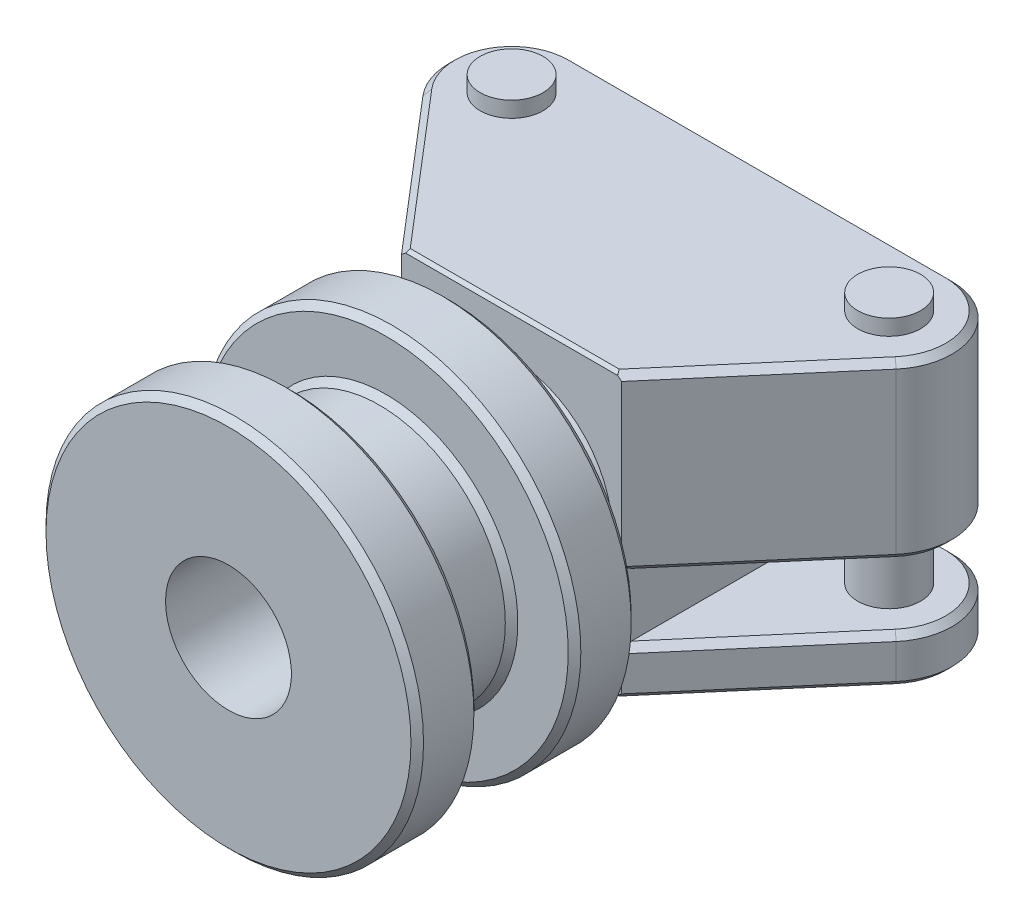
from build123d import *

# Parameters (mm, degrees)
SKETCH1_R                = 6
BOSS_EXTRUDE1_DEPTH      = 2
SKETCH2_R                = 4
BOSS_EXTRUDE2_DEPTH      = 3
BOSS_EXTRUDE3_START      = 2
SKETCH3_R                = 6
BOSS_EXTRUDE3_DEPTH      = 2
SKETCH4_R                = 3
BOSS_EXTRUDE4_DEPTH      = 2
SKETCH5_R                = 1
BOSS_EXTRUDE5_DEPTH      = 4.5
CUT_EXTRUDE1_REACH       = 21.723
SKETCH6_W                = 4.5
SKETCH6_H                = 2
SKETCH7_R                = 2
CUT_EXTRUDE2_DEPTH       = 20.723082923
CHAMFER1_SIZE            = 0.2
CHAMFER2_SIZE            = 0.1
BOSS_EXTRUDE6_DEPTH      = 0.5
BOSS_EXTRUDE6_DEPTH_BACK = 9.5
SKETCH8_R                = 1
BOSS_EXTRUDE7_DEPTH      = 0.5
BOSS_EXTRUDE7_DEPTH_BACK = 9.5
SKETCH9_R                = 1


with BuildPart() as part:
    # Sketch1 → Boss-Extrude1 (new body)
    with BuildSketch(Plane.XY):
        Circle(SKETCH1_R)
    extrude(amount=BOSS_EXTRUDE1_DEPTH)

    # Sketch2 → Boss-Extrude2 (add)
    with BuildSketch(Plane(origin=(0, 0, 0), x_dir=(-1, 0, 0), z_dir=(0, 0, -1))):
        Circle(SKETCH2_R)
    extrude(amount=BOSS_EXTRUDE2_DEPTH)

    # Sketch3 → Boss-Extrude3 (add)
    with BuildSketch(Plane(origin=(0, 0, -3), x_dir=(-1, 0, 0), z_dir=(0, 0, -1)).offset(BOSS_EXTRUDE3_START)):
        with Locations(Location((0, 0, 0), (0, 0, 180))):
            Circle(SKETCH3_R)
    extrude(amount=-BOSS_EXTRUDE3_DEPTH)

    # Sketch4 → Boss-Extrude4 (add)
    with BuildSketch(Plane(origin=(0, 0, -5), x_dir=(-1, 0, 0), z_dir=(0, 0, -1))):
        Circle(SKETCH4_R)
    extrude(amount=BOSS_EXTRUDE4_DEPTH)

    # Sketch5 → Boss-Extrude5 (add, symmetric)
    with BuildSketch(Plane(origin=(0, 0, 0), x_dir=(1, 0, 0), z_dir=(0, 1, 0))):
        with BuildLine():
            Line((3.5, 7), (-3.5, 7))
            Line((-3.5, 7), (-7.519902988, 11.700040421))
            ThreePointArc((-7.519902988, 11.700040421), (-7.816579087, 13.836684183), (-6, 15))
            Line((-6, 15), (6, 15))
            ThreePointArc((6, 15), (7.816579087, 13.836684183), (7.519902988, 11.700040421))
            Line((7.519902988, 11.700040421), (3.5, 7))
        make_face()
        with Locations(Location((-6, 13, 0), (0, 0, 270))):
            Circle(SKETCH5_R, mode=Mode.SUBTRACT)
        with Locations(Location((6, 13, 0), (0, 0, 90))):
            Circle(SKETCH5_R, mode=Mode.SUBTRACT)
    extrude(amount=BOSS_EXTRUDE5_DEPTH, both=True)

    # Cut-Extrude1: up to this face of the body (flat: up to its plane)
    cut_extrude1_end = Plane(part.part.faces().sort_by_distance((3.385982457, 0, -7))[0])
    # Sketch6 → Cut-Extrude1 (cut, up to the picked face)
    with BuildSketch(Plane(origin=(0, 0, -15), x_dir=(-1, 0, 0), z_dir=(0, 0, -1)), mode=Mode.PRIVATE) as cut_extrude1_sk1:
        with Locations((-5.75, -2)):
            Rectangle(SKETCH6_W, SKETCH6_H)
    cut_extrude1_tool1 = split(extrude(cut_extrude1_sk1.sketch, amount=-CUT_EXTRUDE1_REACH, mode=Mode.PRIVATE), bisect_by=cut_extrude1_end, keep=Keep.BOTH, mode=Mode.PRIVATE)
    # Sketch6 → Cut-Extrude1 (cut, up to the picked face)
    with BuildSketch(Plane(origin=(0, 0, -15), x_dir=(-1, 0, 0), z_dir=(0, 0, -1)), mode=Mode.PRIVATE) as cut_extrude1_sk2:
        with Locations((5.75, 2)):
            Rectangle(SKETCH6_W, SKETCH6_H)
    cut_extrude1_tool2 = split(extrude(cut_extrude1_sk2.sketch, amount=-CUT_EXTRUDE1_REACH, mode=Mode.PRIVATE), bisect_by=cut_extrude1_end, keep=Keep.BOTH, mode=Mode.PRIVATE)
    add(cut_extrude1_tool1.solids().sort_by(Axis((5.75, -2, -15), (0, 0, 1)))[0], mode=Mode.SUBTRACT)
    add(cut_extrude1_tool2.solids().sort_by(Axis((-5.75, 2, -15), (0, 0, 1)))[0], mode=Mode.SUBTRACT)

    # Sketch7 → Cut-Extrude2 (cut, through all)
    with BuildSketch(Plane(origin=(0, 0, -15), x_dir=(-1, 0, 0), z_dir=(0, 0, -1))):
        Circle(SKETCH7_R)
    extrude(amount=-CUT_EXTRUDE2_DEPTH, mode=Mode.SUBTRACT)

    # Chamfer1
    chamfer1_edges = [part.edges().sort_by_distance(p)[0] for p in [
        (-6, 0, -3),
        (-6, 0, -5),
        (3, 0, -5),
        (3, 0, -7),
        (-5.509951494, 4.5, -9.350020211),
        (-6, 0, 0),
        (5.509951494, 4.5, -9.350020211),
        (7.816579087, 4.5, -13.836684183),
        (0, 4.5, -15),
        (-7.816579087, 4.5, -13.836684183),
        (-5.509951494, -4.5, -9.350020211),
        (5.509951494, -4.5, -9.350020211),
        (7.816579087, -4.5, -13.836684183),
        (0, -4.5, -15),
        (-7.816579087, -4.5, -13.836684183),
        (-6, 0, 2),
        (4.75, -1, -15),
        (4.75, -3, -15),
        (3.5, -2, -15),
        (5.509951494, -1, -9.350020211),
        (7.816579087, -1, -13.836684183),
        (7.816579087, -3, -13.836684183),
        (5.509951494, -3, -9.350020211),
        (4, 0, 0),
        (-5.509951494, 1, -9.350020211),
        (4, 0, -3),
        (-7.816579087, 1, -13.836684183),
        (-7.816579087, 3, -13.836684183),
        (-5.509951494, 3, -9.350020211),
        (-4.75, 3, -15),
        (-3.5, 2, -15),
        (-4.75, 1, -15),
    ]]
    chamfer(chamfer1_edges, length=CHAMFER1_SIZE)

    # Chamfer2
    chamfer2_edges = [part.edges().sort_by_distance(p)[0] for p in [
        (0, -4.5, -7),
        (0, 4.5, -7),
        (3.5, -2, -7),
        (-3.5, 2, -7),
    ]]
    chamfer(chamfer2_edges, length=CHAMFER2_SIZE)


with BuildPart() as body_2:
    # Sketch8 → Boss-Extrude6 (new, two sides: drawn at the far end of the back side and taken through both)
    with BuildSketch(Plane(origin=(0, 4.5, 0), x_dir=(1, 0, 0), z_dir=(0, 1, 0)).offset(-BOSS_EXTRUDE6_DEPTH_BACK)):
        with Locations(Location((-6, 13, 0), (0, 0, 270))):
            Circle(SKETCH8_R)
    extrude(amount=BOSS_EXTRUDE6_DEPTH + BOSS_EXTRUDE6_DEPTH_BACK)


with BuildPart() as body_3:
    # Sketch9 → Boss-Extrude7 (new, two sides: drawn at the far end of the back side and taken through both)
    with BuildSketch(Plane(origin=(0, 4.5, 0), x_dir=(1, 0, 0), z_dir=(0, 1, 0)).offset(-BOSS_EXTRUDE7_DEPTH_BACK)):
        with Locations(Location((6, 13, 0), (0, 0, 270))):
            Circle(SKETCH9_R)
    extrude(amount=BOSS_EXTRUDE7_DEPTH + BOSS_EXTRUDE7_DEPTH_BACK)


solid = Compound([part.part, body_2.part, body_3.part])
